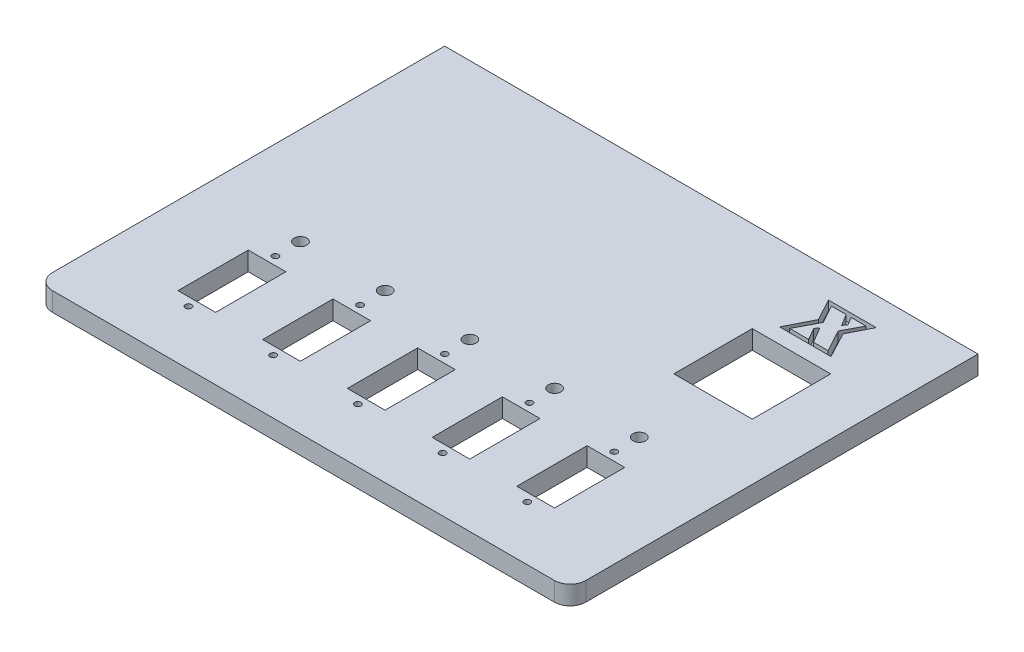
from build123d import *

# Parameters (mm, degrees)
SKETCH1_W               = 170
SKETCH1_H               = 130
BOSS_EXTRUDE1_DEPTH     = 6
SKETCH2_R               = 1
SKETCH2_R_2             = 2
SKETCH2_W               = 12
SKETCH2_H               = 22.4
CUT_EXTRUDE1_DEPTH      = 10
LPATTERN1_COUNT         = 5
LPATTERN1_PITCH         = 27
SKETCH8_W               = 25
SKETCH8_H               = 25
CUT_EXTRUDE5_DEPTH      = 108.172757733
FILLET2_R               = 5
SKETCH10_R              = 9
CUT_EXTRUDE6_DEPTH      = 2.6
MIRROR2_COPY_1_SKETCH_R = 9
MIRROR2_COPY_1_DEPTH    = 2.6
CUT_EXTRUDE7_DEPTH      = 3


with BuildPart() as part:
    # Sketch1 → Boss-Extrude1 (new body)
    with BuildSketch(Plane(origin=(0, 0, 0), x_dir=(1, 0, 0), z_dir=(0, 1, 0))):
        Rectangle(SKETCH1_W, SKETCH1_H)
    extrude(amount=BOSS_EXTRUDE1_DEPTH)

    # Sketch2 → Cut-Extrude1 (cut)
    with BuildSketch(Plane(origin=(0, 6, 0), x_dir=(1, 0, 0), z_dir=(0, 1, 0))):
        with Locations(Location((-54, -19.95, 0), (0, 0, 270))):
            Circle(SKETCH2_R)
        with Locations(Location((-54, -47.65, 0), (0, 0, 270))):
            Circle(SKETCH2_R)
        with Locations(Location((-54, -11.95, 0), (0, 0, 270))):
            Circle(SKETCH2_R_2)
        with Locations((-54, -33.8)):
            Rectangle(SKETCH2_W, SKETCH2_H)
    cut_extrude1 = extrude(amount=-CUT_EXTRUDE1_DEPTH, mode=Mode.SUBTRACT)

    # LPattern1: Cut-Extrude1 ×5
    with Locations(*[(i * LPATTERN1_PITCH, 0, 0) for i in range(1, LPATTERN1_COUNT)]):
        add(cut_extrude1, mode=Mode.SUBTRACT)

    # Sketch8 → Cut-Extrude5 (cut, through all)
    with BuildSketch(Plane(origin=(0, 6, 0), x_dir=(1, 0, 0), z_dir=(0, 1, 0))):
        with Locations((54.5, 23.55)):
            Rectangle(SKETCH8_W, SKETCH8_H)
    extrude(amount=-CUT_EXTRUDE5_DEPTH, mode=Mode.SUBTRACT)

    # Fillet2
    fillet2_edges = [part.edges().sort_by_distance(p)[0] for p in [
        (85, 3, 65),
        (-85, 3, 65),
    ]]
    fillet(fillet2_edges, radius=FILLET2_R)

    # Sketch10 → Cut-Extrude6 (cut)
    with BuildSketch(Plane.XZ):
        with Locations(Location((-73, 53, 0), (0, 0, 270))):
            Circle(SKETCH10_R)
    cut_extrude6 = extrude(amount=-CUT_EXTRUDE6_DEPTH, mode=Mode.SUBTRACT)

    # Mirror1: Cut-Extrude6 across plane
    add(cut_extrude6.mirror(Plane(origin=(0, 0, 0), x_dir=(0, 0, 1), z_dir=(1, 0, 0))), mode=Mode.SUBTRACT)

    # Mirror2: Cut-Extrude6 across plane
    add(cut_extrude6.mirror(Plane.XY), mode=Mode.SUBTRACT)

    # Mirror2 copy 1 sketch → Mirror2 copy 1 (cut)
    with BuildSketch(Plane(origin=(0, 0, 0), x_dir=(-1, 0, 0), z_dir=(0, -1, 0))):
        with Locations(Location((-73, 53, 0), (0, 0, 270))):
            Circle(MIRROR2_COPY_1_SKETCH_R)
    extrude(amount=-MIRROR2_COPY_1_DEPTH, mode=Mode.SUBTRACT)

    # Sketch11 → Cut-Extrude7 (cut)
    with BuildSketch(Plane(origin=(0, 6, 0), x_dir=(1, 0, 0), z_dir=(0, 1, 0))):
        Polygon((45.897368421, 40.869502872), (50.042105263, 49.063376227), (46.292105263, 56.066871293), (61.489473684, 56.066871293), (57.936842105, 49.072627872), (62.278947368, 40.869502872), align=None)
        Polygon((47.932730263, 42.053713398), (53.989473684, 42.053713398), (51.765995066, 45.856139385), (52.55546875, 47.065020964), (55.525246711, 42.053713398), (60.17265625, 42.053713398), (56.357894737, 49.069543991), (59.438692434, 54.882660767), (54.686430921, 54.882660767), (56.191365132, 52.366213398), (55.380304276, 51.151164056), (53.088980263, 54.882660767), (48.404564145, 54.882660767), (51.621052632, 49.075711754), align=None, mode=Mode.SUBTRACT)
    extrude(amount=-CUT_EXTRUDE7_DEPTH, mode=Mode.SUBTRACT)


solid = part.part
